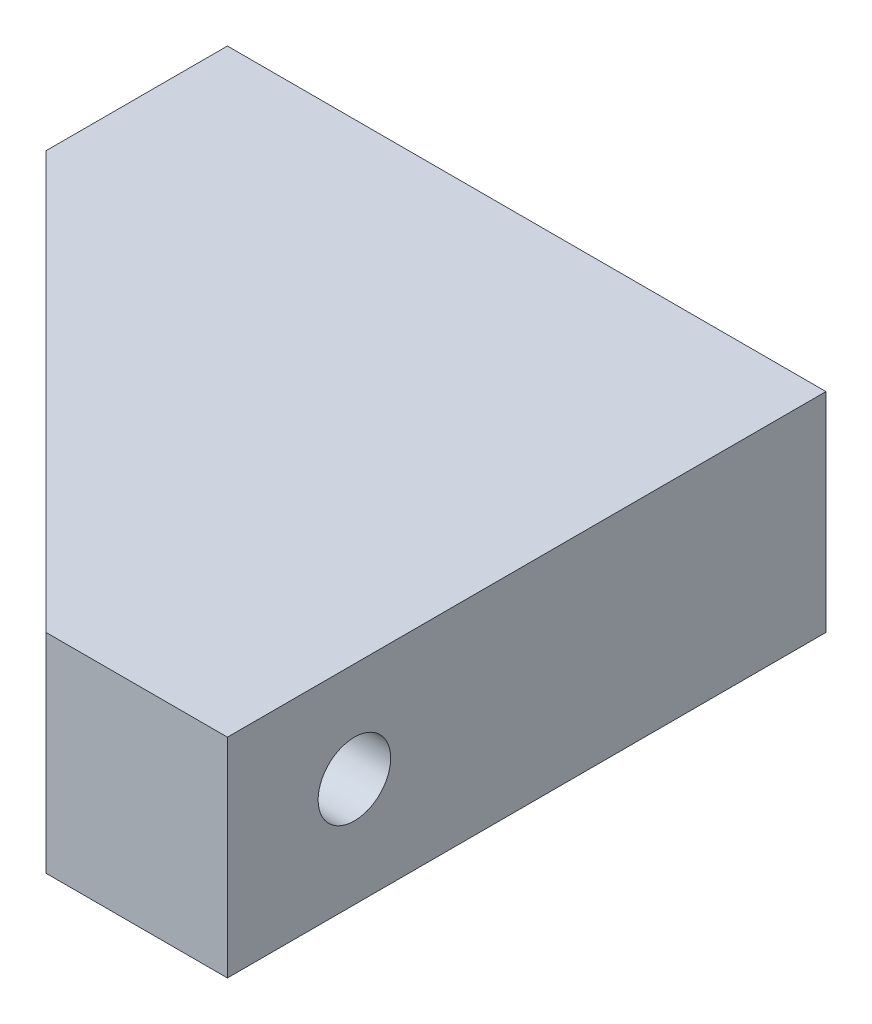
from build123d import *

# Parameters (mm, degrees)
SKETCH1_W           = 33
SKETCH1_H           = 23
BOSS_EXTRUDE1_DEPTH = 10
SKETCH2_W           = 10
SKETCH2_H           = 23
BOSS_EXTRUDE2_DEPTH = 23
SKETCH3_R           = 2
CUT_EXTRUDE1_DEPTH  = 33
SKETCH4_R           = 2
CUT_EXTRUDE2_DEPTH  = 33
BOSS_EXTRUDE3_DEPTH = 23
SKETCH6_R           = 3.5
CUT_EXTRUDE3_DEPTH  = 33
SKETCH7_R           = 3.5
CUT_EXTRUDE4_DEPTH  = 33
SKETCH8_W           = 33
SKETCH8_H           = 11.5
CUT_EXTRUDE5_DEPTH  = 53


with BuildPart() as part:
    # Sketch1 → Boss-Extrude1 (new body)
    with BuildSketch(Plane.XY):
        with Locations((-15.439393939, -2.291666667)):
            Rectangle(SKETCH1_W, SKETCH1_H)
    extrude(amount=BOSS_EXTRUDE1_DEPTH)

    # Sketch2 → Boss-Extrude2 (add)
    with BuildSketch(Plane.XY.offset(10)):
        with Locations((-3.939393939, -2.291666667)):
            Rectangle(SKETCH2_W, SKETCH2_H)
    extrude(amount=BOSS_EXTRUDE2_DEPTH)

    # Sketch3 → Cut-Extrude1 (cut)
    with BuildSketch(Plane.XY.offset(10)):
        with Locations((-24.939393939, 3.208333333)):
            Circle(SKETCH3_R)
        with Locations((-24.939393939, -7.791666667)):
            Circle(SKETCH3_R)
    extrude(amount=-CUT_EXTRUDE1_DEPTH, mode=Mode.SUBTRACT)

    # Sketch4 → Cut-Extrude2 (cut)
    with BuildSketch(Plane.ZY.offset(8.939393939)):
        with Locations(Location((26, 3.208333333, 0), (0, 0, 270))):
            Circle(SKETCH4_R)
        with Locations(Location((26, -7.791666667, 0), (0, 0, 270))):
            Circle(SKETCH4_R)
    extrude(amount=-CUT_EXTRUDE2_DEPTH, mode=Mode.SUBTRACT)

    # Sketch5 → Boss-Extrude3 (add)
    with BuildSketch(Plane(origin=(0, -13.791666667, 0), x_dir=(-1, 0, 0), z_dir=(0, -1, 0))):
        Polygon((8.939393939, -10), (8.939393939, -33), (31.939393939, -10), align=None)
    extrude(amount=-BOSS_EXTRUDE3_DEPTH)

    # Sketch6 → Cut-Extrude3 (cut)
    with BuildSketch(Plane(origin=(-8.939393939, 0, 0), x_dir=(0, 0, -1), z_dir=(1, 0, 0))):
        with Locations((-26, -7.791666667)):
            Circle(SKETCH6_R)
        with Locations((-26, 3.208333333)):
            Circle(SKETCH6_R)
    extrude(amount=-CUT_EXTRUDE3_DEPTH, mode=Mode.SUBTRACT)

    # Sketch7 → Cut-Extrude4 (cut)
    with BuildSketch(Plane(origin=(0, 0, 10), x_dir=(-1, 0, 0), z_dir=(0, 0, -1))):
        with Locations((24.939393939, -7.791666667)):
            Circle(SKETCH7_R)
        with Locations((24.939393939, 3.208333333)):
            Circle(SKETCH7_R)
    extrude(amount=-CUT_EXTRUDE4_DEPTH, mode=Mode.SUBTRACT)

    # Sketch8 → Cut-Extrude5 (cut)
    with BuildSketch(Plane.ZY.offset(31.939393939)):
        with Locations((16.5, 3.458333333)):
            Rectangle(SKETCH8_W, SKETCH8_H)
    extrude(amount=-CUT_EXTRUDE5_DEPTH, mode=Mode.SUBTRACT)


solid = part.part
